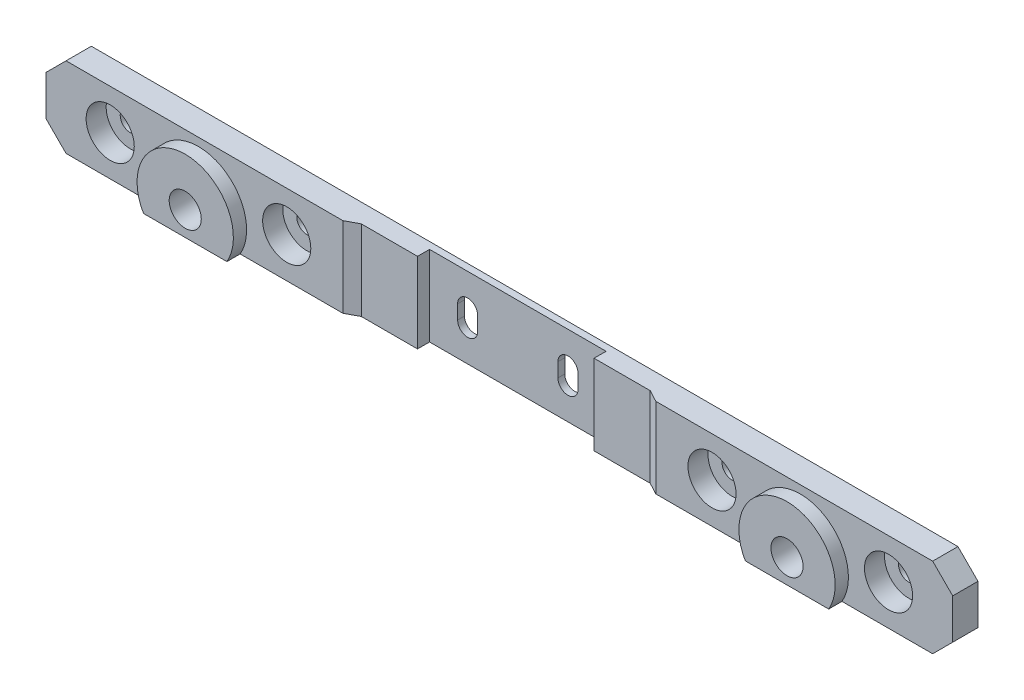
from build123d import *

# Parameters (mm, degrees)
SKETCH1_R           = 4
SKETCH1_R_2         = 2.5
BOSS_EXTRUDE1_DEPTH = 9.6
CUT_EXTRUDE1_START  = -3.3
SKETCH2_R           = 2.5
CUT_EXTRUDE1_DEPTH  = 3.3
CUT_EXTRUDE2_DEPTH  = 228.086239125
SKETCH5_R           = 6
CUT_EXTRUDE3_DEPTH  = 5


with BuildPart() as part:
    # Sketch1 → Boss-Extrude1 (new body)
    with BuildSketch(Plane.XY):
        Polygon((221, 0), (5, 0), (0, -5), (0, -15), (5, -20), (221, -20), (226, -15), (226, -5), align=None)
        with Locations((38, -14)):
            Circle(SKETCH1_R, mode=Mode.SUBTRACT)
        with Locations((188, -14)):
            Circle(SKETCH1_R, mode=Mode.SUBTRACT)
        with Locations((16, -10)):
            Circle(SKETCH1_R_2, mode=Mode.SUBTRACT)
        with Locations((60, -10)):
            Circle(SKETCH1_R_2, mode=Mode.SUBTRACT)
        with BuildLine():
            ThreePointArc((98, -8.25), (100.5, -5.75), (103, -8.25))
            Line((103, -8.25), (103, -11.75))
            ThreePointArc((103, -11.75), (100.5, -14.25), (98, -11.75))
            Line((98, -11.75), (98, -8.25))
        make_face(mode=Mode.SUBTRACT)
        with BuildLine():
            Line((128, -8.25), (128, -11.75))
            ThreePointArc((128, -11.75), (125.5, -14.25), (123, -11.75))
            Line((123, -11.75), (123, -8.25))
            ThreePointArc((123, -8.25), (125.5, -5.75), (128, -8.25))
        make_face(mode=Mode.SUBTRACT)
        with Locations((166, -10)):
            Circle(SKETCH1_R_2, mode=Mode.SUBTRACT)
        with Locations((210, -10)):
            Circle(SKETCH1_R_2, mode=Mode.SUBTRACT)
    extrude(amount=BOSS_EXTRUDE1_DEPTH)

    # Sketch2 → Cut-Extrude1 (cut)
    # profile 1 of 2: a face of its own
    with BuildSketch(Plane.XY.offset(9.6).offset(CUT_EXTRUDE1_START)):
        with BuildLine():
            Line((48.392304845, -20), (113, -20))
            Line((113, -20), (113, 0))
            Line((113, 0), (5, 0))
            Line((5, 0), (0, -5))
            Line((0, -5), (0, -15))
            Line((0, -15), (5, -20))
            Line((5, -20), (27.607695155, -20))
            ThreePointArc((27.607695155, -20), (34.894171459, -2.408890085), (50, -14))
            ThreePointArc((50, -14), (49.591109915, -17.105828541), (48.392304845, -20))
        make_face()
        with Locations((16, -10)):
            Circle(SKETCH2_R, mode=Mode.SUBTRACT)
        with Locations((60, -10)):
            Circle(SKETCH2_R, mode=Mode.SUBTRACT)
        with BuildLine():
            Line((98, -11.75), (98, -8.25))
            ThreePointArc((98, -8.25), (100.5, -5.75), (103, -8.25))
            Line((103, -8.25), (103, -11.75))
            ThreePointArc((103, -11.75), (100.5, -14.25), (98, -11.75))
        make_face(mode=Mode.SUBTRACT)
    # profile 2 of 2: a face of its own
    with BuildSketch(Plane.XY.offset(9.6).offset(CUT_EXTRUDE1_START)):
        with BuildLine():
            Line((113, 0), (113, -20))
            Line((113, -20), (177.607695155, -20))
            ThreePointArc((177.607695155, -20), (184.894171459, -2.408890085), (200, -14))
            ThreePointArc((200, -14), (199.591109915, -17.105828541), (198.392304845, -20))
            Line((198.392304845, -20), (221, -20))
            Line((221, -20), (226, -15))
            Line((226, -15), (226, -5))
            Line((226, -5), (221, 0))
            Line((221, 0), (113, 0))
        make_face()
        with BuildLine():
            Line((123, -11.75), (123, -8.25))
            ThreePointArc((123, -8.25), (125.5, -5.75), (128, -8.25))
            Line((128, -8.25), (128, -11.75))
            ThreePointArc((128, -11.75), (125.5, -14.25), (123, -11.75))
        make_face(mode=Mode.SUBTRACT)
        with Locations((166, -10)):
            Circle(SKETCH2_R, mode=Mode.SUBTRACT)
        with Locations((210, -10)):
            Circle(SKETCH2_R, mode=Mode.SUBTRACT)
    extrude(amount=CUT_EXTRUDE1_DEPTH, mode=Mode.SUBTRACT)

    # Sketch4 → Cut-Extrude2 (cut, through all)
    with BuildSketch(Plane.XZ.offset(20)):
        Polygon((149, 4.7), (152, 6.3), (113, 6.3), (74, 6.3), (77, 4.7), (91, 4.7), (91, 1.7), (135, 1.7), (135, 4.7), align=None)
    extrude(amount=-CUT_EXTRUDE2_DEPTH, mode=Mode.SUBTRACT)

    # Sketch5 → Cut-Extrude3 (cut)
    with BuildSketch(Plane.XY.offset(6.3)):
        with Locations((16, -10)):
            Circle(SKETCH5_R)
        with Locations((60, -10)):
            Circle(SKETCH5_R)
        with Locations((166, -10)):
            Circle(SKETCH5_R)
        with Locations((210, -10)):
            Circle(SKETCH5_R)
    extrude(amount=-CUT_EXTRUDE3_DEPTH, mode=Mode.SUBTRACT)


solid = part.part
